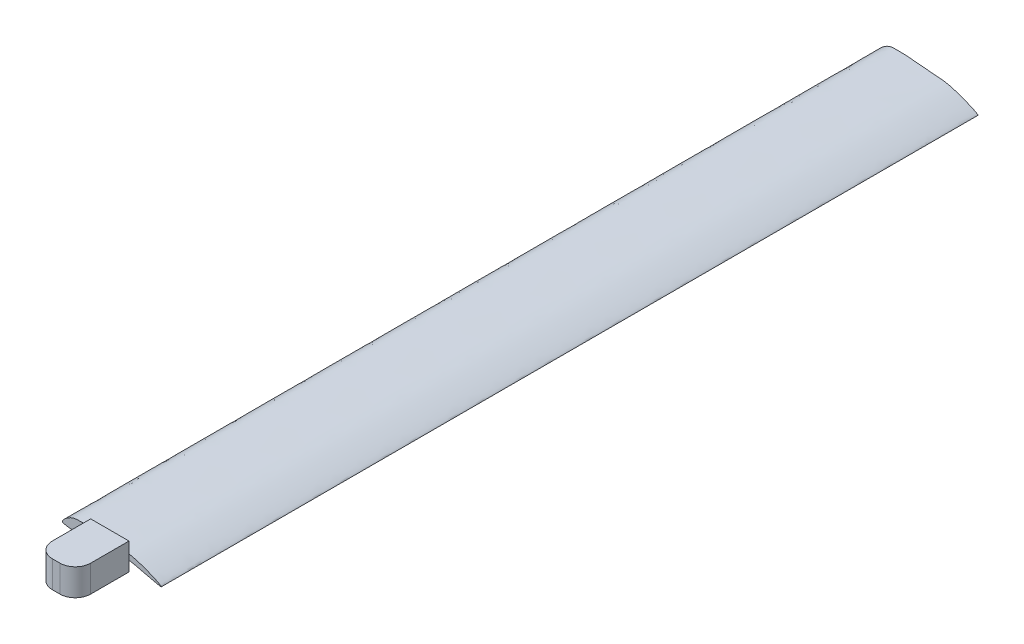
from build123d import *

# Parameters (mm, degrees)
SKETCH1_W           = 50
SKETCH1_H           = 70
BOSS_EXTRUDE1_DEPTH = 35
FILLET1_R           = 20
BOSS_EXTRUDE2_DEPTH = 1065


with BuildPart() as part:
    # Sketch1 → Boss-Extrude1 (new body)
    with BuildSketch(Plane(origin=(0, 0, 0), x_dir=(1, 0, 0), z_dir=(0, 1, 0))):
        with Locations((4.617834395, -8.328025478)):
            Rectangle(SKETCH1_W, SKETCH1_H)
    extrude(amount=BOSS_EXTRUDE1_DEPTH)

    # Fillet1
    fillet1_edges = [part.edges().sort_by_distance(p)[0] for p in [
        (29.617834395, 17.5, 43.328025478),
        (-20.382165605, 17.5, 43.328025478),
    ]]
    fillet(fillet1_edges, radius=FILLET1_R)

    # Sketch2 → Boss-Extrude2 (add)
    with BuildSketch(Plane(origin=(0, 0, -26.671974522), x_dir=(-1, 0, 0), z_dir=(0, 0, -1))):
        with BuildLine():
            add(Edge.make_bspline(
                [(56.722148901, 12.913293113), (58.589926299, 14.965104588), (47.219045714, 24.586480163), (31.687882118, 26.049087), (13.579747114, 24.611263392), (-11.337922493, 21.731344132), (-34.483451913, 22.820737932), (-92.560831912, -3.100632405), (-44.400686991, 10.542725842), (-26.561940096, 14.134422728), (-6.856520396, 14.236401498), (16.177677618, 11.429658109), (45.13214894, 9.531156438), (56.225602316, 12.367821268), (56.722148901, 12.913293113)],
                knots=[0, 0, 0, 0, 0.054770283, 0.091548509, 0.195016085, 0.25072031, 0.368624144, 0.511364754, 0.64293149, 0.680511621, 0.734131637, 0.854393798, 0.98543938, 1, 1, 1, 1], degree=3))
        make_face()
    extrude(amount=BOSS_EXTRUDE2_DEPTH)


solid = part.part
